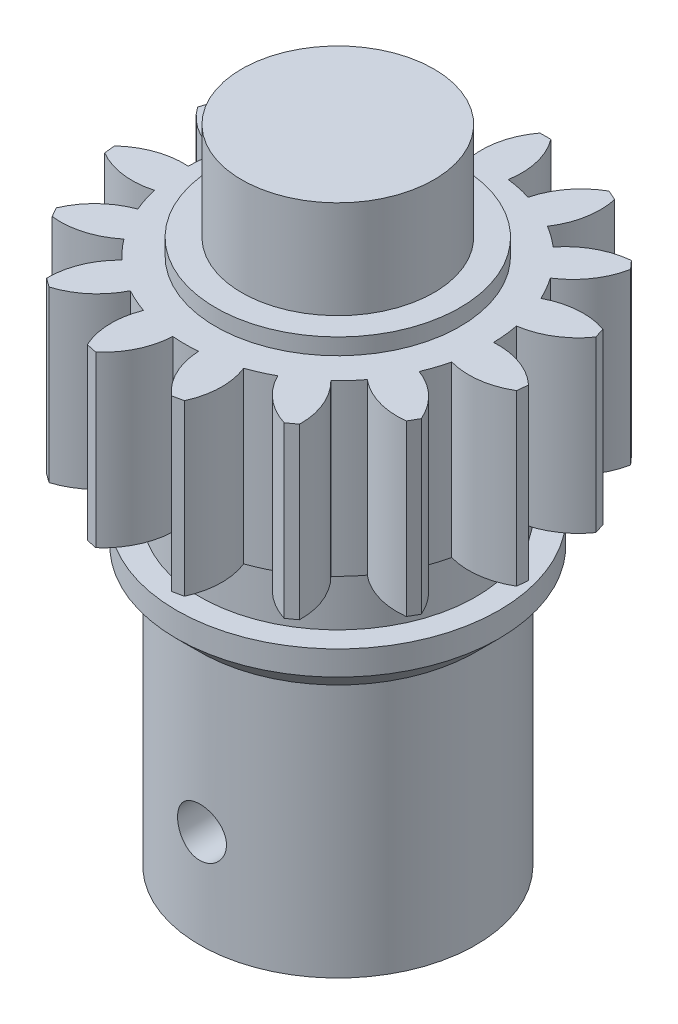
from build123d import *
from build123d.topology import SkipClean

# Parameters (mm, degrees)
RESSALTO_EXTRUS_O1_START   = -10.4
RESSALTO_EXTRUS_O1_DEPTH   = 10.4
PADR_OCIRCULAR1_COUNT      = 15
CORTE_EXTRUS_O1_DEPTH      = 22
ESBO_O4_R                  = 3.25
CORTE_EXTRUS_O2_DEPTH      = 4
CORTE_EXTRUS_O4_DEPTH      = 44.317435995
CORTE_EXTRUS_O4_DEPTH_BACK = 44.317435995
ESBO_O7_R                  = 1.5


with BuildPart() as part:
    # Esboço1 → Revolução1 (revolve)
    with BuildSketch(Plane.XY, mode=Mode.PRIVATE) as revolu_o1_sk:
        Polygon((0, 0), (0, 39.4), (5.9, 39.4), (5.9, 33.4), (7.5, 33.4), (7.5, 32.4), (9.374, 32.4), (9.374, 22), (8.47, 22), (8.47, 18.51), (9.9, 18.51), (9.9, 17.01), (8.47, 15.58), (8.47, 0), align=None)
    revolve(revolu_o1_sk.sketch.rotate(Axis((0, 0, 0), (0, 1, 0)), 90), axis=Axis((0, 0, 0), (0, 1, 0)))

    # Esboço2 → Ressalto-extrusão1 (add)
    with BuildSketch(Plane(origin=(0, 32.4, 0), x_dir=(1, 0, 0), z_dir=(0, 1, 0)).offset(RESSALTO_EXTRUS_O1_START)):
        with BuildLine():
            Line((-0.337, 12.746), (0.337, 12.746))
            ThreePointArc((0.337, 12.746), (1.105703178, 11.108702403), (1.167644885, 9.300993572))
            ThreePointArc((1.167644885, 9.300993572), (0, 9.374), (-1.167644885, 9.300993572))
            ThreePointArc((-1.167644885, 9.300993572), (-1.105703178, 11.108702403), (-0.337, 12.746))
        make_face()
    ressalto_extrus_o1 = extrude(amount=RESSALTO_EXTRUS_O1_DEPTH)

    # PadrãoCircular1: Ressalto-extrusão1 ×15 about axis
    padr_ocircular1_axis = Axis((0, 0, 0), (0, 1, 0))
    for i in range(1, PADR_OCIRCULAR1_COUNT):
        add(ressalto_extrus_o1.rotate(padr_ocircular1_axis, i * 360 / PADR_OCIRCULAR1_COUNT))

    # Esboço3 → Corte-extrusão1 (cut)
    with BuildSketch(Plane.XZ):
        with BuildLine():
            Line((2.65, 1.881488772), (2.65, -1.881488772))
            ThreePointArc((2.65, -1.881488772), (-0.044028005, -3.249701761), (-2.7, -1.809005252))
            Line((-2.7, -1.809005252), (-2.7, 1.809005252))
            ThreePointArc((-2.7, 1.809005252), (-0.044028005, 3.249701761), (2.65, 1.881488772))
        make_face()
    extrude(amount=-CORTE_EXTRUS_O1_DEPTH, mode=Mode.SUBTRACT)

    # Esboço4 → Corte-extrusão2 (cut)
    with SkipClean():  # the faces are left unmerged after this step: merging them gives an invalid solid
        with BuildSketch(Plane.XZ):
            with Locations(Location((0, 0, 0), (0, 0, 270))):
                Circle(ESBO_O4_R)
        extrude(amount=-CORTE_EXTRUS_O2_DEPTH, mode=Mode.SUBTRACT)

    # Esboço7 → Corte-extrusão4 (cut, two sides: drawn at the far end of the back side and taken through both)
    with BuildSketch(Plane.XY.offset(-CORTE_EXTRUS_O4_DEPTH_BACK)):
        with Locations((0, 6)):
            Circle(ESBO_O7_R)
    extrude(amount=CORTE_EXTRUS_O4_DEPTH + CORTE_EXTRUS_O4_DEPTH_BACK, mode=Mode.SUBTRACT)


solid = part.part
